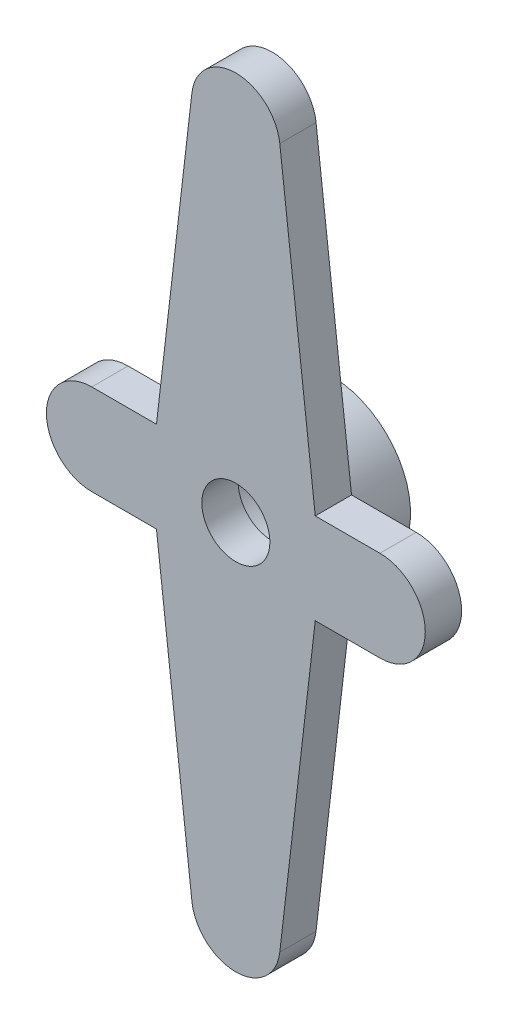
from build123d import *

# Parameters (mm, degrees)
EXTRUDE_1_DEPTH     = 1.6
SKETCH_2_R          = 3.5
SKETCH_2_R_2        = 2.5
EXTRUDE_2_DEPTH     = 2.6
SKETCH_7_R          = 1.5
CUT_EXTRUDE_1_DEPTH = 6


with BuildPart() as part:
    # 草图1 → 凸台-拉伸1 (new body)
    with BuildSketch(Plane.XY):
        with BuildLine():
            Line((-6.349999999, 7.050124355), (-3.5, 7.050124355))
            Line((-3.5, 7.050124355), (-1.936935669, 20.485344653))
            ThreePointArc((-1.936935669, 20.485344653), (0, 22.21), (1.936935669, 20.485344653))
            Line((1.936935669, 20.485344653), (3.5, 7.050124355))
            Line((3.5, 7.050124355), (6.349999999, 7.050124355))
            ThreePointArc((6.349999999, 7.050124355), (8.349999999, 5.050124355), (6.349999999, 3.050124355))
            Line((6.349999999, 3.050124355), (3.5, 3.050124355))
            Line((3.5, 3.050124355), (1.936935669, -10.385095943))
            ThreePointArc((1.936935669, -10.385095943), (0, -12.10975129), (-1.936935669, -10.385095943))
            Line((-1.936935669, -10.385095943), (-3.5, 3.050124355))
            Line((-3.5, 3.050124355), (-6.349999999, 3.050124355))
            ThreePointArc((-6.349999999, 3.050124355), (-8.349999999, 5.050124355), (-6.349999999, 7.050124355))
        make_face()
    extrude(amount=EXTRUDE_1_DEPTH)

    # 草图2 → 凸台-拉伸2 (add)
    with BuildSketch(Plane(origin=(0, 0, 0), x_dir=(-1, 0, 0), z_dir=(0, 0, -1))):
        with Locations((0, 5.05)):
            Circle(SKETCH_2_R)
        with Locations((0, 5.05)):
            Circle(SKETCH_2_R_2, mode=Mode.SUBTRACT)
    extrude(amount=EXTRUDE_2_DEPTH)

    # 草图7 → 切除-拉伸1 (cut)
    with BuildSketch(Plane(origin=(0, 0, 0), x_dir=(-1, 0, 0), z_dir=(0, 0, -1))):
        with Locations((0, 5.05)):
            Circle(SKETCH_7_R)
    extrude(amount=-CUT_EXTRUDE_1_DEPTH, mode=Mode.SUBTRACT)


solid = part.part
